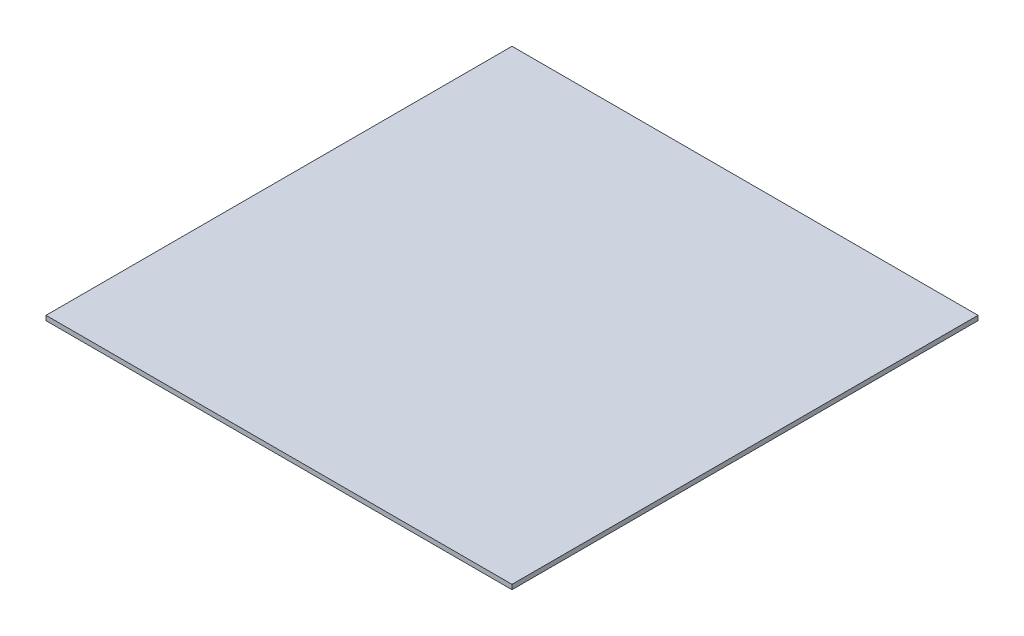
from build123d import *

# Parameters (mm, degrees)
SKETCH1_W      = 30480
SKETCH1_H      = 30480
EXTRUDE1_DEPTH = 304.8


with BuildPart() as part:
    # Sketch1 → Extrude1 (new body)
    with BuildSketch(Plane(origin=(0, 0, 0), x_dir=(1, 0, 0), z_dir=(0, 1, 0))):
        Rectangle(SKETCH1_W, SKETCH1_H)
    extrude(amount=-EXTRUDE1_DEPTH)


solid = part.part
